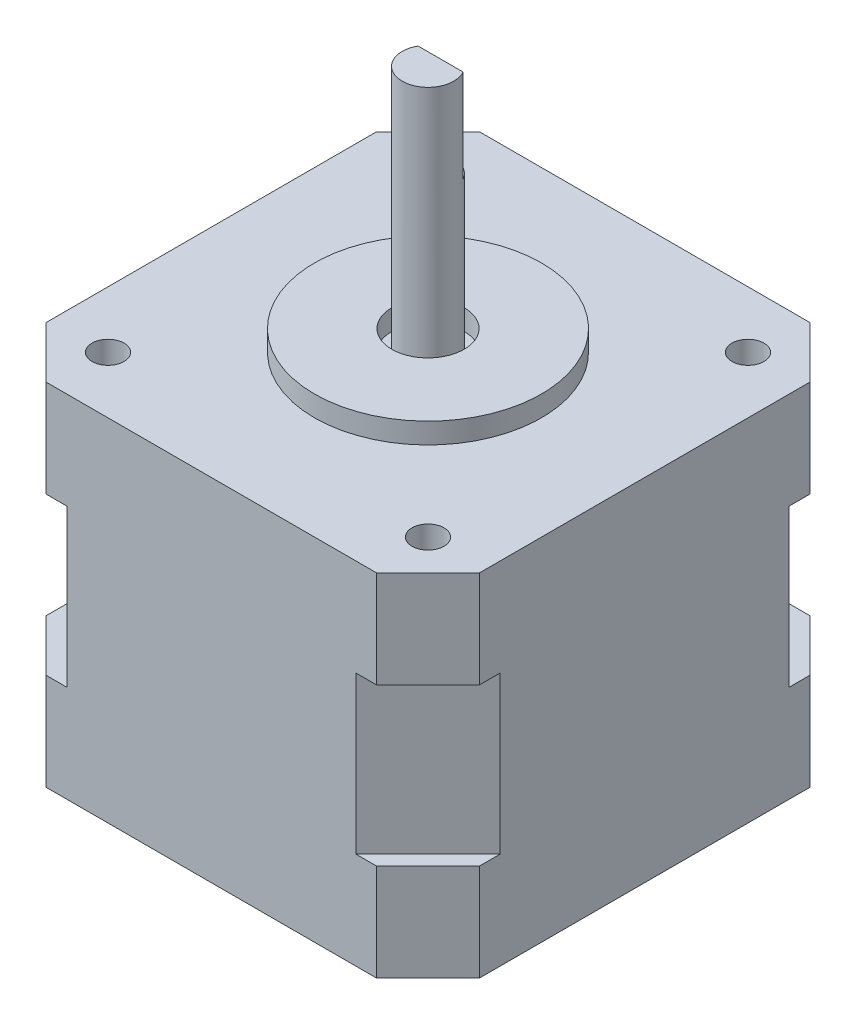
from build123d import *

# Parameters (mm, degrees)
SKETCH4_W               = 42
SKETCH4_H               = 42
BOTTOM_DEPTH            = 9.4
MIDDLE_DEPTH            = 15.2
SKETCH8_W               = 42
SKETCH8_H               = 42
TOP_DEPTH               = 9.4
CHAMFER1_SIZE           = 5
SKETCH9_R               = 11
SKETCH9_R_2             = 3.5
RING_DEPTH              = 2
SKETCH10_R              = 2.5
SHAFT_DEPTH             = 24
CUT_EXTRUDE3_DEPTH      = 5
CUT_EXTRUDE3_DEPTH_BACK = 5
SKETCH11_W              = 2.239647547
SKETCH11_H              = 24.242457261
SKETCH12_R              = 1.55
CUT_EXTRUDE4_DEPTH      = 4.5
CUT_EXTRUDE5_START      = -10
SKETCH15_R              = 1.55
CUT_EXTRUDE5_DEPTH      = 10


with BuildPart() as part:
    # Sketch4 → Bottom (new body)
    with BuildSketch(Plane(origin=(0, 0, 0), x_dir=(1, 0, 0), z_dir=(0, 1, 0))):
        Rectangle(SKETCH4_W, SKETCH4_H)
    extrude(amount=BOTTOM_DEPTH)

    # Sketch6 → Middle (add)
    with BuildSketch(Plane(origin=(0, 9.4, 0), x_dir=(1, 0, 0), z_dir=(0, 1, 0))):
        Polygon((-21, -14), (-14, -21), (14, -21), (21, -14), (21, 14), (14, 21), (-14, 21), (-21, 14), align=None)
    extrude(amount=MIDDLE_DEPTH)

    # Sketch8 → Top (add)
    with BuildSketch(Plane(origin=(0, 24.6, 0), x_dir=(1, 0, 0), z_dir=(0, 1, 0))):
        Rectangle(SKETCH8_W, SKETCH8_H)
    extrude(amount=TOP_DEPTH)

    # Chamfer1
    chamfer1_edges = [part.edges().sort_by_distance(p)[0] for p in [
        (21, 29.3, 21),
        (21, 29.3, -21),
        (-21, 29.3, -21),
        (-21, 29.3, 21),
        (-21, 4.7, 21),
        (-21, 4.7, -21),
        (21, 4.7, -21),
        (21, 4.7, 21),
    ]]
    chamfer(chamfer1_edges, length=CHAMFER1_SIZE)

    # Sketch9 → Ring (add)
    with BuildSketch(Plane(origin=(0, 34, 0), x_dir=(1, 0, 0), z_dir=(0, 1, 0))):
        with Locations(Location((0, 0, 0), (0, 0, 270))):
            Circle(SKETCH9_R)
        with Locations(Location((0, 0, 0), (0, 0, 270))):
            Circle(SKETCH9_R_2, mode=Mode.SUBTRACT)
    extrude(amount=RING_DEPTH)

    # Sketch10 → Shaft (add)
    with BuildSketch(Plane(origin=(0, 34, 0), x_dir=(1, 0, 0), z_dir=(0, 1, 0))):
        with Locations(Location((0, 0, 0), (0, 0, 90))):
            Circle(SKETCH10_R)
    extrude(amount=SHAFT_DEPTH)

    # Sketch11 → Cut-Extrude3 (cut, two sides: drawn at the far end of the back side and taken through both)
    with BuildSketch(Plane(origin=(0, 0, 0), x_dir=(0, 0, -1), z_dir=(1, 0, 0)).offset(-CUT_EXTRUDE3_DEPTH_BACK)):
        with Locations((2.338622492, 61.12122863)):
            Rectangle(SKETCH11_W, SKETCH11_H)
    extrude(amount=CUT_EXTRUDE3_DEPTH + CUT_EXTRUDE3_DEPTH_BACK, mode=Mode.SUBTRACT)

    # Sketch12 → Cut-Extrude4 (cut)
    with BuildSketch(Plane(origin=(0, 34, 0), x_dir=(1, 0, 0), z_dir=(0, 1, 0))):
        with Locations(Location((15.5, -15.5, 0), (0, 0, 270))):
            Circle(SKETCH12_R)
        with Locations(Location((-15.5, -15.5, 0), (0, 0, 270))):
            Circle(SKETCH12_R)
        with Locations(Location((-15.5, 15.5, 0), (0, 0, 270))):
            Circle(SKETCH12_R)
        with Locations(Location((15.5, 15.5, 0), (0, 0, 270))):
            Circle(SKETCH12_R)
    extrude(amount=-CUT_EXTRUDE4_DEPTH, mode=Mode.SUBTRACT)

    # Sketch15 → Cut-Extrude5 (cut)
    with BuildSketch(Plane.XZ.offset(CUT_EXTRUDE5_START)):
        with Locations(Location((15.5, 15.5, 0), (0, 0, 90))):
            Circle(SKETCH15_R)
        with Locations(Location((15.5, -15.5, 0), (0, 0, 90))):
            Circle(SKETCH15_R)
        with Locations(Location((-15.5, 15.5, 0), (0, 0, 90))):
            Circle(SKETCH15_R)
        with Locations(Location((-15.5, -15.5, 0), (0, 0, 90))):
            Circle(SKETCH15_R)
    extrude(amount=CUT_EXTRUDE5_DEPTH, mode=Mode.SUBTRACT)


solid = part.part
